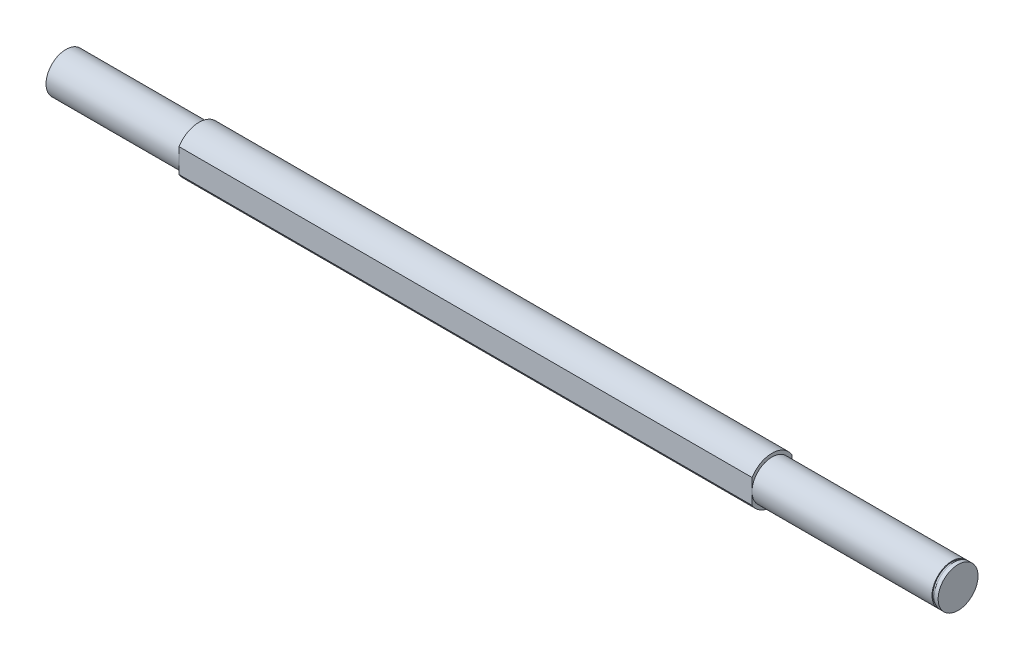
from build123d import *

# Parameters (mm, degrees)
CUT_EXTRUDE1_DEPTH = 431
SKETCH3_W          = 1.6
SKETCH3_H          = 0.7
CUT_EXTRUDE2_DEPTH = 5


with BuildPart() as part:
    # Sketch1 → Revolve1 (revolve)
    with BuildSketch(Plane.XY, mode=Mode.PRIVATE) as revolve1_sk:
        Polygon((-335.5, 0), (335.5, 0), (335.5, 15), (195.5, 15), (195.5, 17.5), (-235.5, 17.5), (-235.5, 15), (-335.5, 15), align=None)
    revolve(revolve1_sk.sketch.rotate(Axis((-335.5, 0, 0), (1, 0, 0)), 90), axis=Axis((-335.5, 0, 0), (1, 0, 0)))

    # Sketch2 → Cut-Extrude1 (cut)
    with BuildSketch(Plane.ZY.offset(235.5)):
        with BuildLine():
            Line((-14.936600675, 9.118550338), (-15.062665819, -8.908765258))
            ThreePointArc((-15.062665819, -8.908765258), (-17.499572122, 0.12237463), (-14.936600675, 9.118550338))
        make_face()
        with BuildLine():
            Line((14.936600675, 9.118550338), (15.062665819, -8.908765258))
            ThreePointArc((15.062665819, -8.908765258), (17.499572122, 0.12237463), (14.936600675, 9.118550338))
        make_face()
    extrude(amount=-CUT_EXTRUDE1_DEPTH, mode=Mode.SUBTRACT)

    # Sketch3 → Cut-Revolve1 (revolve, cut)
    with BuildSketch(Plane(origin=(0, 0, 0), x_dir=(1, 0, 0), z_dir=(0, 1, 0)), mode=Mode.PRIVATE) as cut_revolve1_sk:
        with Locations((331.7, 14.65)):
            Rectangle(SKETCH3_W, SKETCH3_H)
    revolve(cut_revolve1_sk.sketch.rotate(Axis((335.5, 0, 0), (-1, 0, 0)), 180.400663256), axis=Axis((335.5, 0, 0), (-1, 0, 0)), mode=Mode.SUBTRACT)

    # Sketch6 → Cut-Extrude2 (cut)
    with BuildSketch(Plane(origin=(0, 1.378544902, -14.936519473), x_dir=(0, -0.9957679648377556, -0.09190299343804982), z_dir=(0, -0.09190299343804982, 0.9957679648377556))):
        with BuildLine():
            Line((5, 322.5), (5, 292.5))
            ThreePointArc((5, 292.5), (0, 287.5), (-5, 292.5))
            Line((-5, 292.5), (-5, 322.5))
            ThreePointArc((-5, 322.5), (0, 327.5), (5, 322.5))
        make_face()
    extrude(amount=CUT_EXTRUDE2_DEPTH, mode=Mode.SUBTRACT)


solid = part.part
